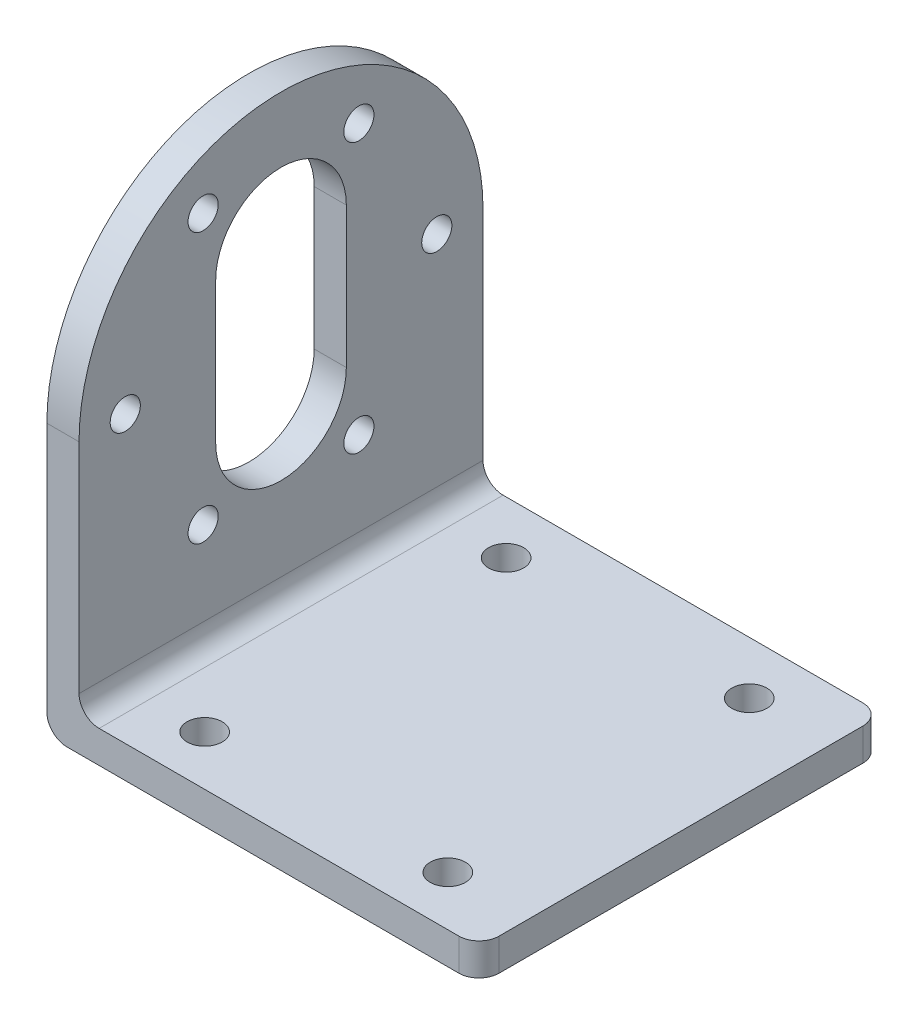
from build123d import *

# Parameters (mm, degrees)
SKETCH_1_W          = 43
SKETCH_1_H          = 40.2
EXTRUDE_1_DEPTH     = 3.2
SKETCH_2_W          = 3.2
SKETCH_2_H          = 40.2
EXTRUDE_2_DEPTH     = 43.8
SKETCH_3_R          = 1.5
CUT_EXTRUDE_1_DEPTH = 43.8
CUT_EXTRUDE_2_DEPTH = 43.8
FILLET_1_R          = 2
FILLET_2_R          = 2
SKETCH_5_R          = 1.75
CUT_EXTRUDE_3_DEPTH = 43.8
FILLET_3_R          = 2


with BuildPart() as part:
    # 草图1 → 凸台-拉伸1 (new body)
    with BuildSketch(Plane(origin=(0, 0, 0), x_dir=(1, 0, 0), z_dir=(0, 1, 0))):
        Rectangle(SKETCH_1_W, SKETCH_1_H)
    extrude(amount=EXTRUDE_1_DEPTH)

    # 草图2 → 凸台-拉伸2 (add)
    with BuildSketch(Plane(origin=(0, 3.2, 0), x_dir=(1, 0, 0), z_dir=(0, 1, 0))):
        with Locations((-19.9, 0)):
            Rectangle(SKETCH_2_W, SKETCH_2_H)
    extrude(amount=EXTRUDE_2_DEPTH)

    # 草图3 → 切除-拉伸1 (cut)
    with BuildSketch(Plane.ZY.offset(21.5)):
        with Locations((-15.5, 27)):
            Circle(SKETCH_3_R)
        with Locations((-7.75, 40.423393759)):
            Circle(SKETCH_3_R)
        with Locations((7.75, 40.423393759)):
            Circle(SKETCH_3_R)
        with Locations((15.5, 27)):
            Circle(SKETCH_3_R)
        with Locations((7.75, 13.576606241)):
            Circle(SKETCH_3_R)
        with Locations((-7.75, 13.576606241)):
            Circle(SKETCH_3_R)
        with BuildLine():
            Line((-6.5, 34), (-6.5, 20))
            ThreePointArc((-6.5, 20), (0, 13.5), (6.5, 20))
            Line((6.5, 20), (6.5, 34))
            ThreePointArc((6.5, 34), (0, 40.5), (-6.5, 34))
        make_face()
    extrude(amount=-CUT_EXTRUDE_1_DEPTH, mode=Mode.SUBTRACT)

    # 草图4 → 切除-拉伸2 (cut)
    with BuildSketch(Plane.ZY.offset(21.5)):
        with BuildLine():
            Line((-20.1, 47), (-20.1, 26.9))
            ThreePointArc((-20.1, 26.9), (-14.21284635, 41.112846253), (-1.37e-07, 47))
            Line((-1.37e-07, 47), (-20.1, 47))
        make_face()
        with BuildLine():
            ThreePointArc((-1.37e-07, 47), (14.212846253, 41.11284635), (20.1, 26.9))
            Line((20.1, 26.9), (20.1, 47))
            Line((20.1, 47), (-1.37e-07, 47))
        make_face()
    extrude(amount=-CUT_EXTRUDE_2_DEPTH, mode=Mode.SUBTRACT)

    # 圆角1
    fillet_1_edges = [part.edges().sort_by_distance(p)[0] for p in [
        (-21.5, 0, 0),
    ]]
    fillet(fillet_1_edges, radius=FILLET_1_R)

    # 圆角2
    fillet_2_edges = [part.edges().sort_by_distance(p)[0] for p in [
        (-18.3, 3.2, 0),
    ]]
    fillet(fillet_2_edges, radius=FILLET_2_R)

    # 草图5 → 切除-拉伸3 (cut)
    with BuildSketch(Plane(origin=(0, 3.2, 0), x_dir=(1, 0, 0), z_dir=(0, 1, 0))):
        with Locations(Location((13.45, 14.85, 0), (0, 0, 270))):
            Circle(SKETCH_5_R)
        with Locations(Location((13.45, -15.15, 0), (0, 0, 270))):
            Circle(SKETCH_5_R)
        with Locations(Location((-10.75, -15.15, 0), (0, 0, 270))):
            Circle(SKETCH_5_R)
        with Locations(Location((-10.75, 14.85, 0), (0, 0, 270))):
            Circle(SKETCH_5_R)
    extrude(amount=-CUT_EXTRUDE_3_DEPTH, mode=Mode.SUBTRACT)

    # 圆角3
    fillet_3_edges = [part.edges().sort_by_distance(p)[0] for p in [
        (21.5, 1.6, -20.1),
        (21.5, 1.6, 20.1),
    ]]
    fillet(fillet_3_edges, radius=FILLET_3_R)


solid = part.part
